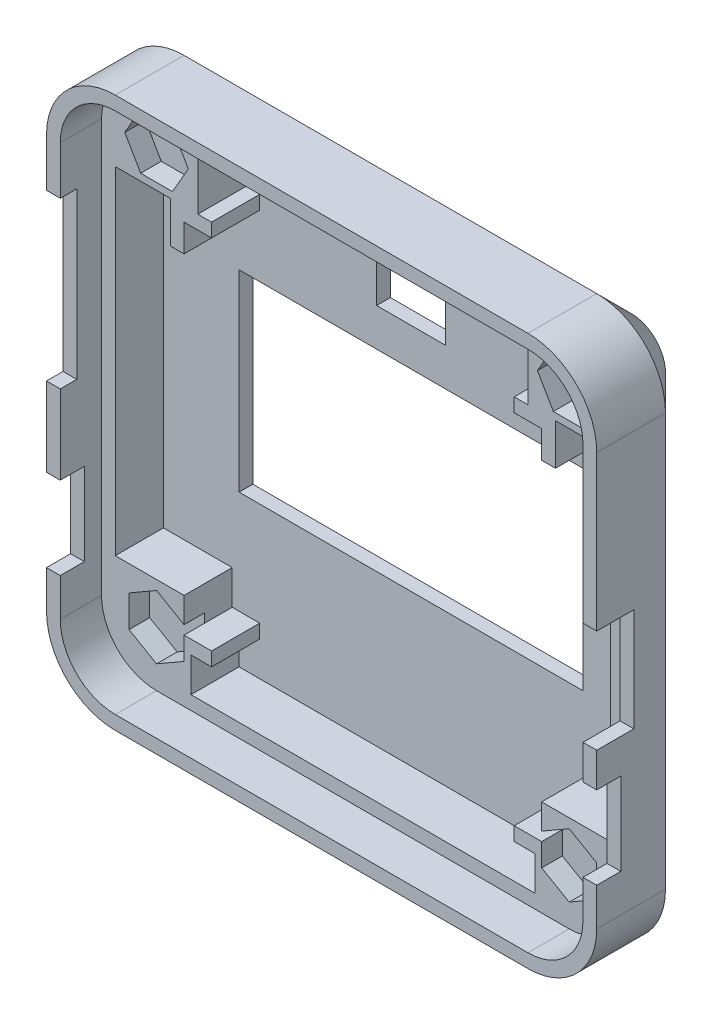
from build123d import *

# Parameters (mm, degrees)
EXTRUDE_1_DEPTH     = 1
SKETCH_3_W          = 25
SKETCH_3_H          = 14
CUT_EXTRUDE_1_DEPTH = 30.381116385
EXTRUDE_START       = 6.5
EXTRUDE_2_DEPTH     = 6.5
EXTRUDE_START_2     = 3.5
EXTRUDE_3_DEPTH     = 3.5
EXTRUDE_4_DEPTH     = 3.5
CHAMFER_1_SIZE      = 2.5
EXTRUDE_5_DEPTH     = 3.5
EXTRUDE_6_DEPTH     = 3.5
CUT_EXTRUDE_2_DEPTH = 1.5
CUT_EXTRUDE_3_DEPTH = 1.5
CUT_EXTRUDE_4_REACH = 47.588
SKETCH_12_W         = 1.75
SKETCH_12_H         = 6
SKETCH_12_W_2       = 2.7
SKETCH_12_H_2       = 7.5
CUT_EXTRUDE_5_REACH = 47.588
SKETCH_13_W         = 1.2
SKETCH_13_H         = 12
SKETCH_14_W         = 5
SKETCH_14_H         = 5
CUT_EXTRUDE_6_DEPTH = 1.5
SKETCH_12_2_W       = 1.75
SKETCH_12_2_H       = 6
CUT_EXTRUDE_7_DEPTH = 46.587827323


with BuildPart() as part:
    # 草圖2 → 填料-伸長1 (new body)
    with BuildSketch(Plane(origin=(0, 0, -2.5), x_dir=(-1, 0, 0), z_dir=(0, 0, -1))):
        with BuildLine():
            Line((-15, -18.5), (15, -18.5))
            ThreePointArc((15, -18.5), (18.535533906, -17.035533906), (20, -13.5))
            Line((20, -13.5), (20, 16.5))
            ThreePointArc((20, 16.5), (18.535533906, 20.035533906), (15, 21.5))
            Line((15, 21.5), (-15, 21.5))
            ThreePointArc((-15, 21.5), (-18.535533906, 20.035533906), (-20, 16.5))
            Line((-20, 16.5), (-20, -13.5))
            ThreePointArc((-20, -13.5), (-18.535533906, -17.035533906), (-15, -18.5))
        make_face()
    extrude(amount=EXTRUDE_1_DEPTH)

    # 草圖3 → 除料-伸長1 (cut, through all)
    with BuildSketch(Plane(origin=(0, 0, -3.5), x_dir=(-1, 0, 0), z_dir=(0, 0, -1))):
        with Locations((0, 1.5)):
            Rectangle(SKETCH_3_W, SKETCH_3_H)
    extrude(amount=-CUT_EXTRUDE_1_DEPTH, mode=Mode.SUBTRACT)

    # 草圖4 → 填料-伸長2 (add)
    with BuildSketch(Plane.XY.offset(-2.5).offset(EXTRUDE_START)):
        with BuildLine():
            Line((15, -18.5), (-15, -18.5))
            ThreePointArc((-15, -18.5), (-18.535533906, -17.035533906), (-20, -13.5))
            Line((-20, -13.5), (-20, 16.5))
            ThreePointArc((-20, 16.5), (-18.535533906, 20.035533906), (-15, 21.5))
            Line((-15, 21.5), (15, 21.5))
            ThreePointArc((15, 21.5), (18.535533906, 20.035533906), (20, 16.5))
            Line((20, 16.5), (20, -13.5))
            ThreePointArc((20, -13.5), (18.535533906, -17.035533906), (15, -18.5))
        make_face()
        with BuildLine():
            Line((19, -13.5), (19, 16.5))
            ThreePointArc((19, 16.5), (17.828427125, 19.328427125), (15, 20.5))
            Line((15, 20.5), (-15, 20.5))
            ThreePointArc((-15, 20.5), (-17.828427125, 19.328427125), (-19, 16.5))
            Line((-19, 16.5), (-19, -13.5))
            ThreePointArc((-19, -13.5), (-17.828427125, -16.328427125), (-15, -17.5))
            Line((-15, -17.5), (15, -17.5))
            ThreePointArc((15, -17.5), (17.828427125, -16.328427125), (19, -13.5))
        make_face(mode=Mode.SUBTRACT)
    extrude(amount=-EXTRUDE_2_DEPTH)

    # 草圖5 → 填料-伸長3 (add)
    with BuildSketch(Plane.XY.offset(-2.5).offset(EXTRUDE_START_2)):
        with BuildLine():
            Line((19, -13.5), (19, 16.5))
            ThreePointArc((19, 16.5), (17.828427125, 19.328427125), (15, 20.5))
            Line((15, 20.5), (-15, 20.5))
            ThreePointArc((-15, 20.5), (-17.828427125, 19.328427125), (-19, 16.5))
            Line((-19, 16.5), (-19, -13.5))
            ThreePointArc((-19, -13.5), (-17.828427125, -16.328427125), (-15, -17.5))
            Line((-15, -17.5), (15, -17.5))
            ThreePointArc((15, -17.5), (17.828427125, -16.328427125), (19, -13.5))
        make_face()
        with BuildLine():
            Line((18, -13.5), (18, 16.5))
            ThreePointArc((18, 16.5), (17.121320344, 18.621320344), (15, 19.5))
            Line((15, 19.5), (-15, 19.5))
            ThreePointArc((-15, 19.5), (-17.121320344, 18.621320344), (-18, 16.5))
            Line((-18, 16.5), (-18, -13.5))
            ThreePointArc((-18, -13.5), (-17.121320344, -15.621320344), (-15, -16.5))
            Line((-15, -16.5), (15, -16.5))
            ThreePointArc((15, -16.5), (17.121320344, -15.621320344), (18, -13.5))
        make_face(mode=Mode.SUBTRACT)
    extrude(amount=-EXTRUDE_3_DEPTH)

    # 草圖6 → 填料-伸長4 (add)
    with BuildSketch(Plane.XY.offset(-2.5)):
        Polygon((14, -14), (14, -10.5), (13, -10.5), (13, -13), (11, -13), (11, -14), align=None)
        Polygon((14, 14), (11, 14), (11, 13), (13, 13), (13, 11), (14, 11), align=None)
        Polygon((-14, 14), (-14, 11), (-13, 11), (-13, 13), (-11, 13), (-11, 14), align=None)
        Polygon((-14, -14), (-11, -14), (-11, -13), (-13, -13), (-13, -10.5), (-14, -10.5), align=None)
    extrude(amount=EXTRUDE_4_DEPTH)

    # 導角1
    chamfer_1_edges = [part.edges().sort_by_distance(p)[0] for p in [
        (18.535533906, -17.035533906, -3.5),
        (0, -18.5, -3.5),
        (-18.535533906, -17.035533906, -3.5),
        (-20, 1.5, -3.5),
        (-18.535533906, 20.035533906, -3.5),
        (0, 21.5, -3.5),
        (18.535533906, 20.035533906, -3.5),
        (20, 1.5, -3.5),
    ]]
    chamfer(chamfer_1_edges, length=CHAMFER_1_SIZE)

    # 草圖7 → 填料-伸長5 (add)
    with BuildSketch(Plane.XY.offset(-2.5).offset(EXTRUDE_START_2)):
        with BuildLine():
            Line((-12, 19.5), (-12, 14))
            Line((-12, 14), (-18, 14))
            Line((-18, 14), (-18, 16.5))
            ThreePointArc((-18, 16.5), (-17.121320344, 18.621320344), (-15, 19.5))
            Line((-15, 19.5), (-12, 19.5))
        make_face()
    extrude_5 = extrude(amount=-EXTRUDE_5_DEPTH)

    # 草圖8 → 填料-伸長6 (add)
    with BuildSketch(Plane.XY.offset(-2.5).offset(EXTRUDE_START_2)):
        with BuildLine():
            Line((-12.5, -16.5), (-12.5, -14))
            Line((-12.5, -14), (-14, -14))
            Line((-14, -14), (-14, -10.5))
            Line((-14, -10.5), (-18, -10.5))
            Line((-18, -10.5), (-18, -13.5))
            ThreePointArc((-18, -13.5), (-17.121320344, -15.621320344), (-15, -16.5))
            Line((-15, -16.5), (-12.5, -16.5))
        make_face()
    extrude_6 = extrude(amount=-EXTRUDE_6_DEPTH)

    # 鏡射2: 填料-伸長5, 填料-伸長6 across plane
    add(extrude_5.mirror(Plane(origin=(0, 0, 0), x_dir=(0, 0, 1), z_dir=(1, 0, 0))))
    add(extrude_6.mirror(Plane(origin=(0, 0, 0), x_dir=(0, 0, 1), z_dir=(1, 0, 0))))

    # 草圖10 → 除料-伸長2 (cut)
    with BuildSketch(Plane.XY.offset(1)):
        Polygon((-15, -15.809401077), (-13, -14.654700538), (-13, -12.345299462), (-15, -11.190598923), (-17, -12.345299462), (-17, -14.654700538), align=None)
    cut_extrude_2 = extrude(amount=-CUT_EXTRUDE_2_DEPTH, mode=Mode.SUBTRACT)

    # 草圖11 → 除料-伸長3 (cut)
    with BuildSketch(Plane.XY.offset(1)):
        Polygon((-17.309401077, 16.5), (-16.154700538, 14.5), (-13.845299462, 14.5), (-12.690598923, 16.5), (-13.845299462, 18.5), (-16.154700538, 18.5), align=None)
    cut_extrude_3 = extrude(amount=-CUT_EXTRUDE_3_DEPTH, mode=Mode.SUBTRACT)

    # 鏡射3: 除料-伸長2, 除料-伸長3 across plane
    add(cut_extrude_2.mirror(Plane(origin=(0, 0, 0), x_dir=(0, 0, 1), z_dir=(1, 0, 0))), mode=Mode.SUBTRACT)
    add(cut_extrude_3.mirror(Plane(origin=(0, 0, 0), x_dir=(0, 0, 1), z_dir=(1, 0, 0))), mode=Mode.SUBTRACT)

    # 草圖12 → 除料-伸長4 (cut, up to next)
    with BuildSketch(Plane(origin=(20, 0, 0), x_dir=(0, 0, -1), z_dir=(1, 0, 0)), mode=Mode.PRIVATE) as cut_extrude_4_sk1:
        with Locations((-3.125, -7.75)):
            Rectangle(SKETCH_12_W, SKETCH_12_H)
    cut_extrude_4_tool1 = extrude(cut_extrude_4_sk1.sketch, amount=-CUT_EXTRUDE_4_REACH, mode=Mode.PRIVATE) & part.part
    # 草圖12 → 除料-伸長4 (cut, up to next)
    with BuildSketch(Plane(origin=(20, 0, 0), x_dir=(0, 0, -1), z_dir=(1, 0, 0)), mode=Mode.PRIVATE) as cut_extrude_4_sk2:
        with Locations((-2.65, 1.5)):
            Rectangle(SKETCH_12_W_2, SKETCH_12_H_2)
    cut_extrude_4_tool2 = extrude(cut_extrude_4_sk2.sketch, amount=-CUT_EXTRUDE_4_REACH, mode=Mode.PRIVATE) & part.part
    add(cut_extrude_4_tool1.solids().sort_by_distance((20, -7.75, 3.125))[0], mode=Mode.SUBTRACT)
    add(cut_extrude_4_tool2.solids().sort_by_distance((20, 1.5, 2.65))[0], mode=Mode.SUBTRACT)

    # 草圖13 → 除料-伸長5 (cut, up to next)
    with BuildSketch(Plane.ZY.offset(20), mode=Mode.PRIVATE) as cut_extrude_5_sk1:
        with Locations((3.4, 7)):
            Rectangle(SKETCH_13_W, SKETCH_13_H)
    cut_extrude_5_tool1 = extrude(cut_extrude_5_sk1.sketch, amount=-CUT_EXTRUDE_5_REACH, mode=Mode.PRIVATE) & part.part
    add(cut_extrude_5_tool1.solids().sort_by_distance((-20, 7, 3.4))[0], mode=Mode.SUBTRACT)

    # 草圖14 → 除料-伸長6 (cut)
    with BuildSketch(Plane(origin=(0, 0, -3.5), x_dir=(-1, 0, 0), z_dir=(0, 0, -1))):
        with Locations((0, 13.75)):
            Rectangle(SKETCH_14_W, SKETCH_14_H)
    extrude(amount=-CUT_EXTRUDE_6_DEPTH, mode=Mode.SUBTRACT)

    # 草圖12<2> → 除料-伸長7 (cut, through all)
    with BuildSketch(Plane(origin=(20, 0, 0), x_dir=(0, 0, -1), z_dir=(1, 0, 0))):
        with Locations((-3.125, -7.75)):
            Rectangle(SKETCH_12_2_W, SKETCH_12_2_H)
    extrude(amount=-CUT_EXTRUDE_7_DEPTH, mode=Mode.SUBTRACT)


solid = part.part
